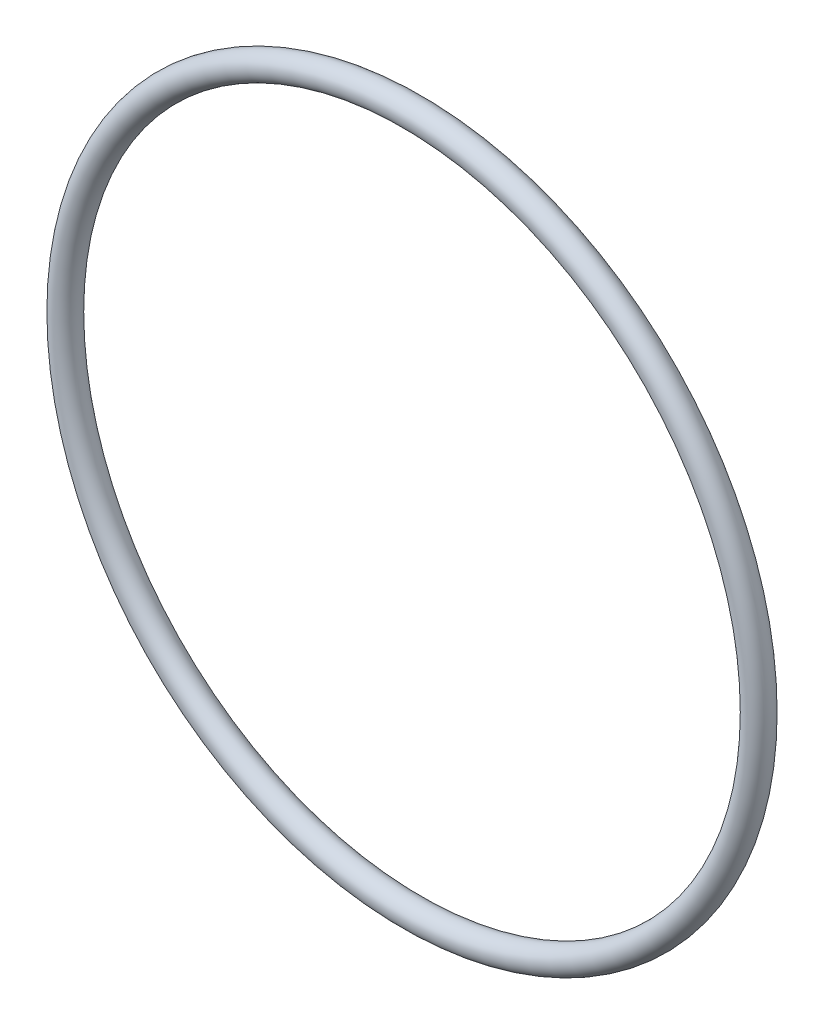
from build123d import *

# Parameters (mm, degrees)
SKETCH1_R = 1.25


with BuildPart() as part:
    # Sketch1 → Revolve1 (revolve)
    with BuildSketch(Plane(origin=(0, 0, 0), x_dir=(0, -1, 0), z_dir=(1, 0, 0))):
        with Locations((33.25, 0)):
            Circle(SKETCH1_R)
    revolve(axis=Axis((0, 0, 1.25), (0, 0, -1)))


solid = part.part
